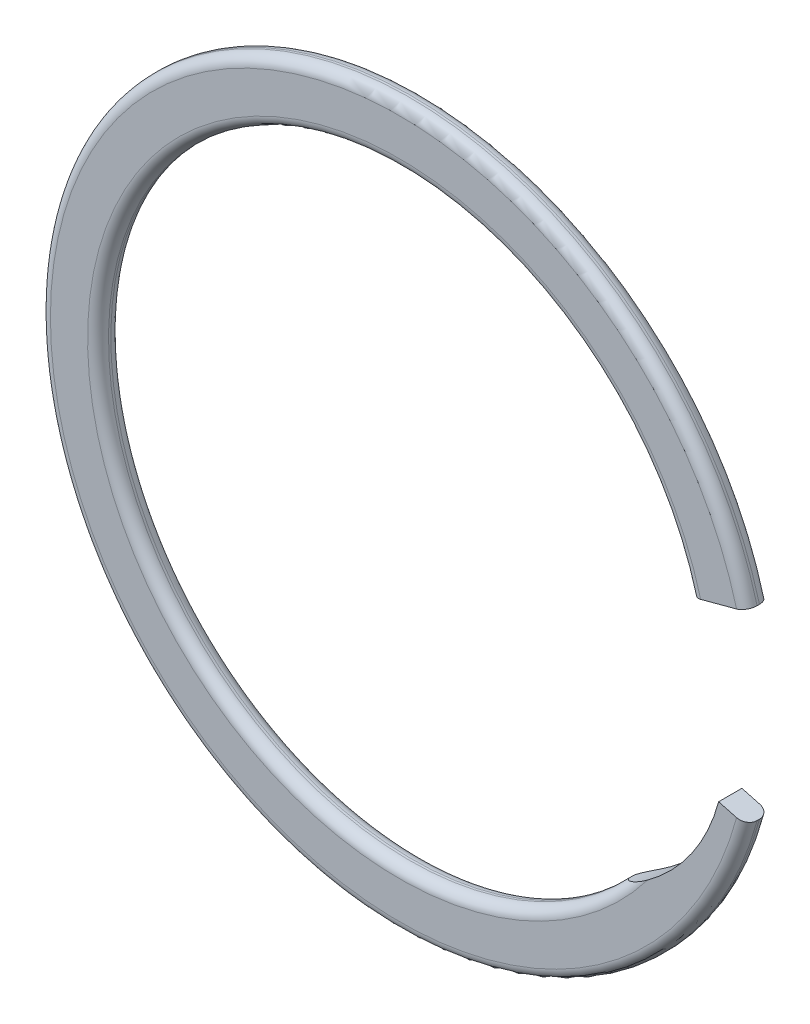
from build123d import *

# Parameters (mm, degrees)
EXTRUDE1_DEPTH = 0.2286
FILLET1_R      = 0.20574


with BuildPart() as part:
    # Sketch2 → Extrude1 (new, symmetric)
    with BuildSketch(Plane.XY):
        with BuildLine():
            Line((6.280836093, -1.682944959), (6.832862703, -1.830860043))
            ThreePointArc((6.832862703, -1.830860043), (-7.0739, 0), (6.832862703, 1.830860043))
            Line((6.832862703, 1.830860043), (5.728809483, 1.535029875))
            ThreePointArc((5.728809483, 1.535029875), (-5.754578473, 1.435409842), (4.336748761, -4.045761362))
            ThreePointArc((4.336748761, -4.045761362), (5.564729157, -3.074933786), (6.280836093, -1.682944959))
        make_face()
    extrude(amount=EXTRUDE1_DEPTH, both=True)

    # Fillet1
    fillet1_edges = [part.edges().sort_by_distance(p)[0] for p in [
        (-7.0739, 0, 0.2286),
        (-5.754578473, 1.435409842, 0.2286),
        (-7.0739, 0, -0.2286),
        (-5.754578473, 1.435409842, -0.2286),
    ]]
    fillet(fillet1_edges, radius=FILLET1_R)


solid = part.part
